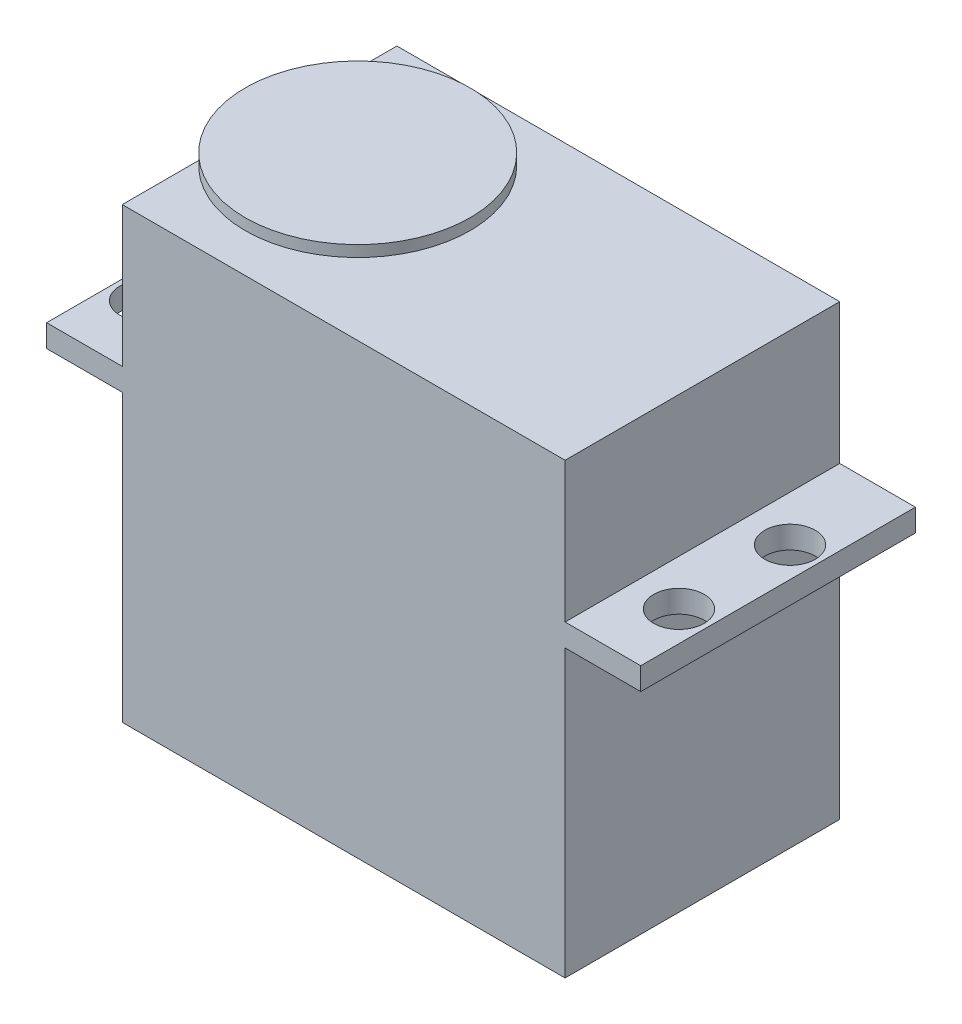
from build123d import *

# Parameters (mm, degrees)
SKETCH1_W           = 39.5
SKETCH1_H           = 24.5
BOSS_EXTRUDE1_DEPTH = 40
SKETCH2_W           = 53
SKETCH2_H           = 24.5
BOSS_EXTRUDE2_DEPTH = 2
SKETCH3_R           = 2.25
CUT_EXTRUDE1_DEPTH  = 2
SKETCH4_R           = 2.5
BOSS_EXTRUDE3_DEPTH = 3
SKETCH5_R           = 10.033
BOSS_EXTRUDE4_DEPTH = 1


with BuildPart() as part:
    # Sketch1 → Boss-Extrude1 (new body)
    with BuildSketch(Plane(origin=(0, 0, 0), x_dir=(1, 0, 0), z_dir=(0, 1, 0))):
        Rectangle(SKETCH1_W, SKETCH1_H)
    extrude(amount=BOSS_EXTRUDE1_DEPTH)

    # Sketch2 → Boss-Extrude2 (add)
    with BuildSketch(Plane(origin=(0, 27.5, 0), x_dir=(1, 0, 0), z_dir=(0, 1, 0))):
        Rectangle(SKETCH2_W, SKETCH2_H)
    extrude(amount=-BOSS_EXTRUDE2_DEPTH)

    # Sketch3 → Cut-Extrude1 (cut)
    with BuildSketch(Plane(origin=(0, 27.5, 0), x_dir=(1, 0, 0), z_dir=(0, 1, 0))):
        with Locations(Location((-23.814, 3.752, 0), (0, 0, 270))):
            Circle(SKETCH3_R)
        with Locations(Location((-23.814, -6.154, 0), (0, 0, 270))):
            Circle(SKETCH3_R)
        with Locations(Location((23.814, 3.752, 0), (0, 0, 270))):
            Circle(SKETCH3_R)
        with Locations(Location((23.814, -6.154, 0), (0, 0, 270))):
            Circle(SKETCH3_R)
    extrude(amount=-CUT_EXTRUDE1_DEPTH, mode=Mode.SUBTRACT)

    # Sketch4 → Boss-Extrude3 (add)
    with BuildSketch(Plane(origin=(0, 40, 0), x_dir=(1, 0, 0), z_dir=(0, 1, 0))):
        with Locations(Location((-9.25, -1.75, 0), (0, 0, 270))):
            Circle(SKETCH4_R)
    extrude(amount=BOSS_EXTRUDE3_DEPTH)

    # Sketch5 → Boss-Extrude4 (add)
    with BuildSketch(Plane(origin=(0, 43, 0), x_dir=(1, 0, 0), z_dir=(0, 1, 0))):
        with Locations(Location((-9.25, -1.75, 0), (0, 0, 270))):
            Circle(SKETCH5_R)
    extrude(amount=BOSS_EXTRUDE4_DEPTH)


solid = part.part
